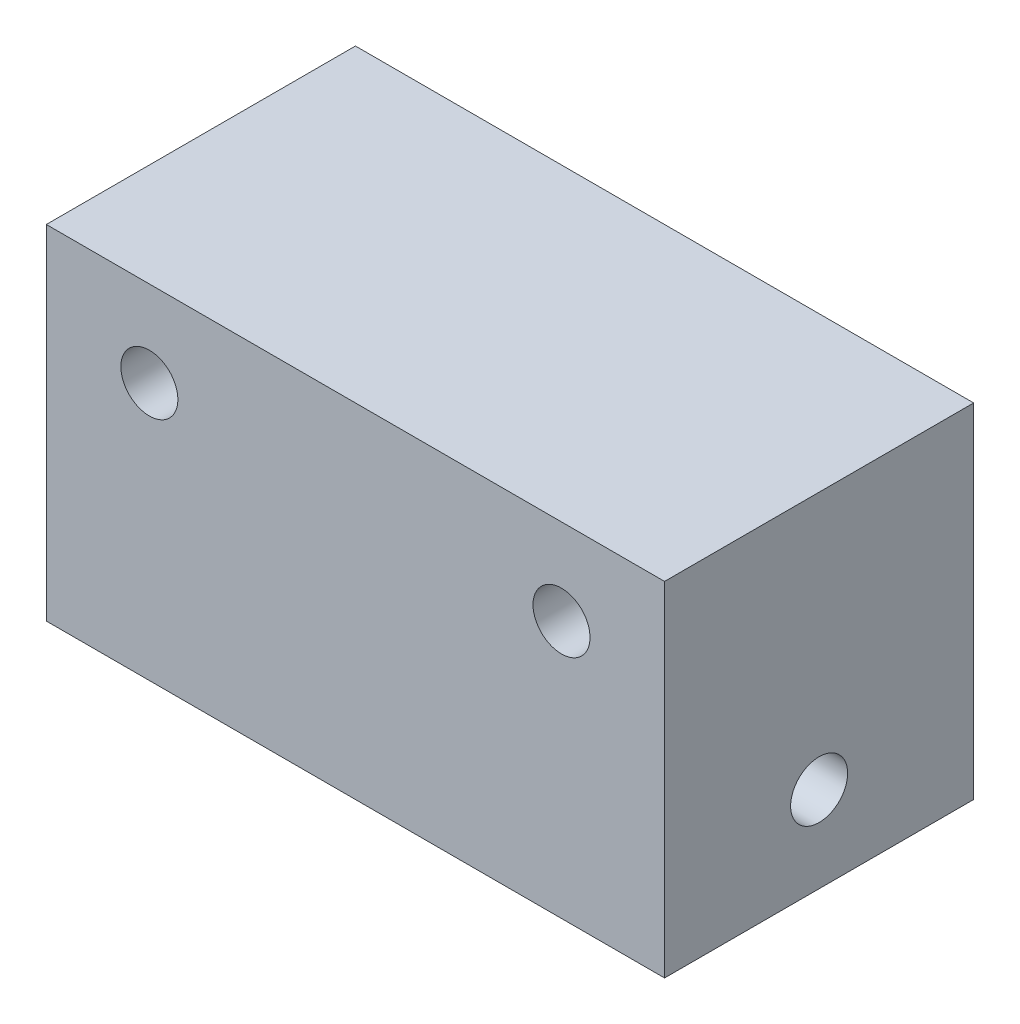
from build123d import *

# Parameters (mm, degrees)
SKETCH1_W           = 90
SKETCH1_H           = 45
BOSS_EXTRUDE1_DEPTH = 50
SKETCH2_R           = 4.15
CUT_EXTRUDE1_DEPTH  = 28.296664924
SKETCH3_R           = 4.15
CUT_EXTRUDE2_DEPTH  = 106.386194542


with BuildPart() as part:
    # Sketch1 → Boss-Extrude1 (new body)
    with BuildSketch(Plane(origin=(0, 0, 0), x_dir=(1, 0, 0), z_dir=(0, 1, 0))):
        Rectangle(SKETCH1_W, SKETCH1_H)
    extrude(amount=BOSS_EXTRUDE1_DEPTH)

    # Sketch2 → Cut-Extrude1 (cut)
    with BuildSketch(Plane.XY.offset(22.5)):
        with Locations((-30, 37.5)):
            Circle(SKETCH2_R)
        with Locations(Location((30, 37.5, 0), (0, 0, 180))):
            Circle(SKETCH2_R)
    extrude(amount=-CUT_EXTRUDE1_DEPTH, mode=Mode.SUBTRACT)

    # Sketch3 → Cut-Extrude2 (cut, through all)
    with BuildSketch(Plane(origin=(45, 0, 0), x_dir=(0, 0, -1), z_dir=(1, 0, 0))):
        with Locations((0, 12.5)):
            Circle(SKETCH3_R)
    extrude(amount=-CUT_EXTRUDE2_DEPTH, mode=Mode.SUBTRACT)


solid = part.part
